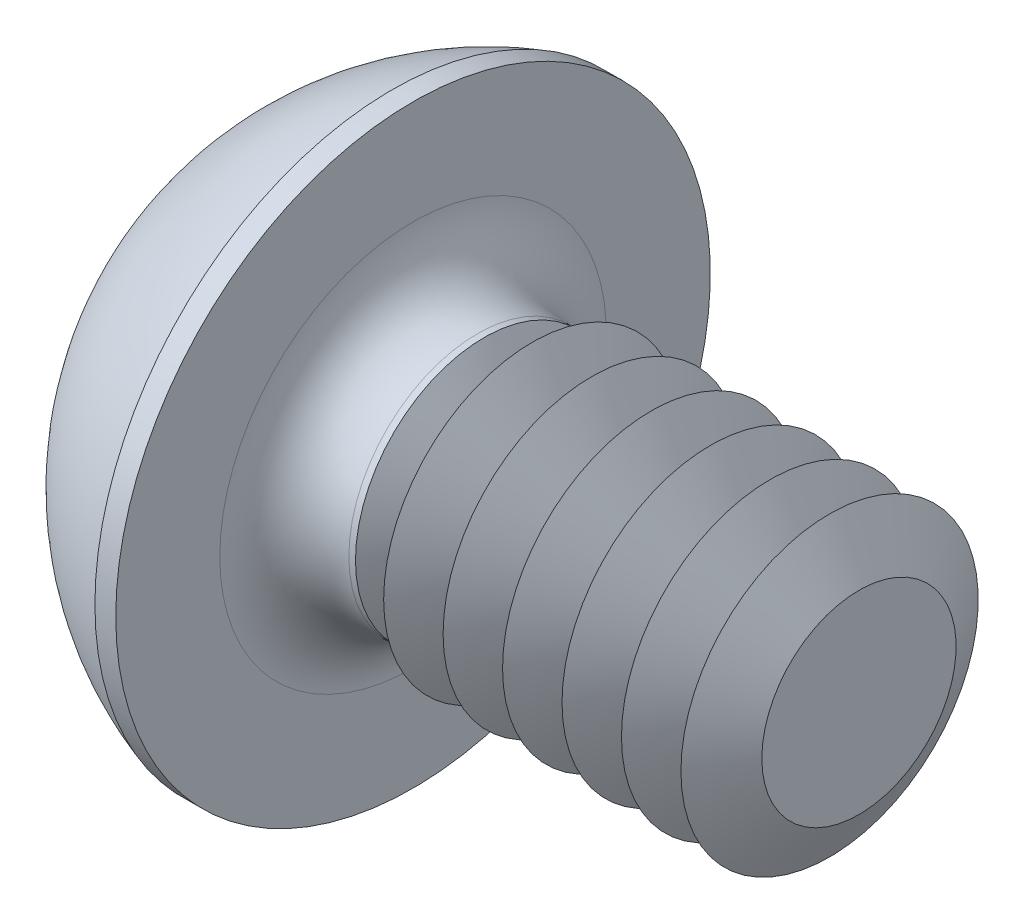
from build123d import *

# Parameters (mm, degrees)
PATTERN_LINEAR_1_COUNT = 7
PATTERN_LINEAR_1_PITCH = 0.4


with BuildPart() as part:
    # 草图2 → Revolve 808 (revolve)
    with BuildSketch(Plane.XY, mode=Mode.PRIVATE) as revolve_808_sk:
        with BuildLine():
            Line((0, 0), (4.6, 0))
            Line((4.6, 0), (4.6, 1))
            Line((4.6, 1), (2.4, 1))
            Line((2.4, 1), (2.266, 0.866))
            Line((2.266, 0.866), (2.034, 0.866))
            ThreePointArc((2.034, 0.866), (1.727115657, 0.993115657), (1.6, 1.3))
            Line((1.6, 1.3), (1.6, 2))
            Line((1.6, 2), (1.459687576, 2))
            ThreePointArc((1.459687576, 2), (0.40373114, 1.23801129), (0, 0))
        make_face()
    revolve(revolve_808_sk.sketch.rotate(Axis((-1.331757704, 0, 0), (1, 0, 0)), 90), axis=Axis((-1.331757704, 0, 0), (1, 0, 0)))

    # 草图3 → 切除-旋转1 (revolve, cut)
    with BuildSketch(Plane.XY, mode=Mode.PRIVATE) as cut_revolve_1_sk:
        Polygon((4.402166402, 1), (4.802166402, 1), (4.6, 0.6536), align=None)
    cut_revolve_1 = revolve(cut_revolve_1_sk.sketch.rotate(Axis((-0.242766179, 0, 0), (1, 0, 0)), 90), axis=Axis((-0.242766179, 0, 0), (1, 0, 0)), mode=Mode.SUBTRACT)

    # 阵列(线性)1: 切除-旋转1 ×7
    with Locations(*[(-i * PATTERN_LINEAR_1_PITCH, 0, 0) for i in range(1, PATTERN_LINEAR_1_COUNT)]):
        add(cut_revolve_1, mode=Mode.SUBTRACT)

    # 草图5 → 切除-放样1 section 0
    with BuildSketch(Plane(origin=(0, 0, 0), x_dir=(0, 0, -1), z_dir=(1, 0, 0)), mode=Mode.PRIVATE) as loft_1_s0:
        with BuildLine():
            Line((0.2, 0.95), (-0.2, 0.95))
            Line((-0.2, 0.95), (-0.2, -0.95))
            Line((-0.2, -0.95), (0.2, -0.95))
            Line((0.2, -0.95), (0.2, 0.95))
        make_face()
    loft_1 = loft([Vertex(1.2, 0, 0), loft_1_s0.sketch], mode=Mode.SUBTRACT)

    # 镜向1: 切除-放样1 across plane
    add(loft_1.mirror(Plane(origin=(0, 0, 0), x_dir=(0, 0.7071067811865462, 0.7071067811865488), z_dir=(0, -0.7071067811865488, 0.7071067811865462))), mode=Mode.SUBTRACT)


solid = part.part
